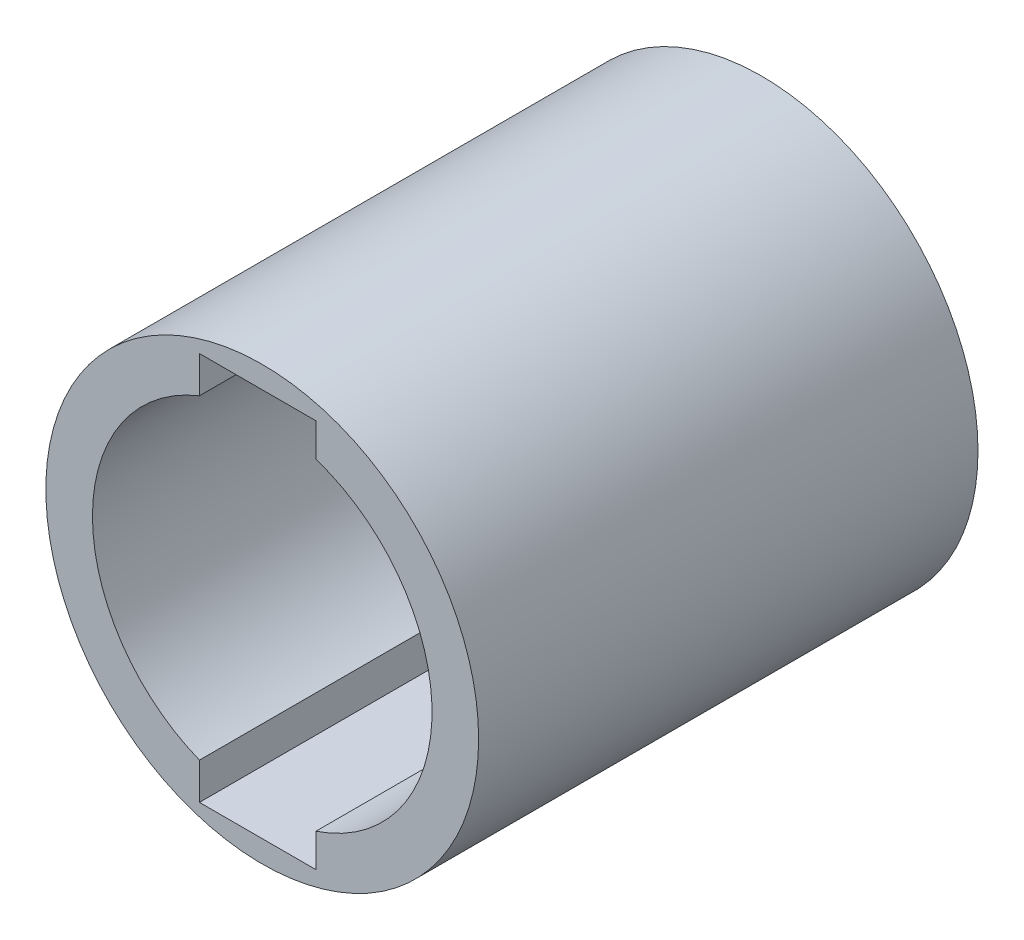
from build123d import *

# Parameters (mm, degrees)
SKETCH1_R           = 6.5
BOSS_EXTRUDE1_DEPTH = 15
CUT_EXTRUDE1_DEPTH  = 18.592612086


with BuildPart() as part:
    # Sketch1 → Boss-Extrude1 (new body)
    with BuildSketch(Plane(origin=(0, 0, 0), x_dir=(0, 1, 0), z_dir=(0, 0, 1))):
        with Locations(Location((0, 0, 0), (0, 0, 270))):
            Circle(SKETCH1_R)
    extrude(amount=BOSS_EXTRUDE1_DEPTH)

    # Sketch2 → Cut-Extrude1 (cut, through all)
    with BuildSketch(Plane.XY.offset(15)):
        with BuildLine():
            Line((-1.886299685, 4.738340796), (-1.886299685, 5.838340796))
            Line((-1.886299685, 5.838340796), (1.612593669, 5.838340796))
            Line((1.612593669, 5.838340796), (1.612593669, 4.838340796))
            ThreePointArc((1.612593669, 4.838340796), (5.1, 0), (1.612593669, -4.838340796))
            Line((1.612593669, -4.838340796), (1.612593669, -5.838340796))
            Line((1.612593669, -5.838340796), (-1.886299685, -5.838340796))
            Line((-1.886299685, -5.838340796), (-1.886299685, -4.738340796))
            ThreePointArc((-1.886299685, -4.738340796), (-5.1, 0), (-1.886299685, 4.738340796))
        make_face()
    extrude(amount=-CUT_EXTRUDE1_DEPTH, mode=Mode.SUBTRACT)


solid = part.part
